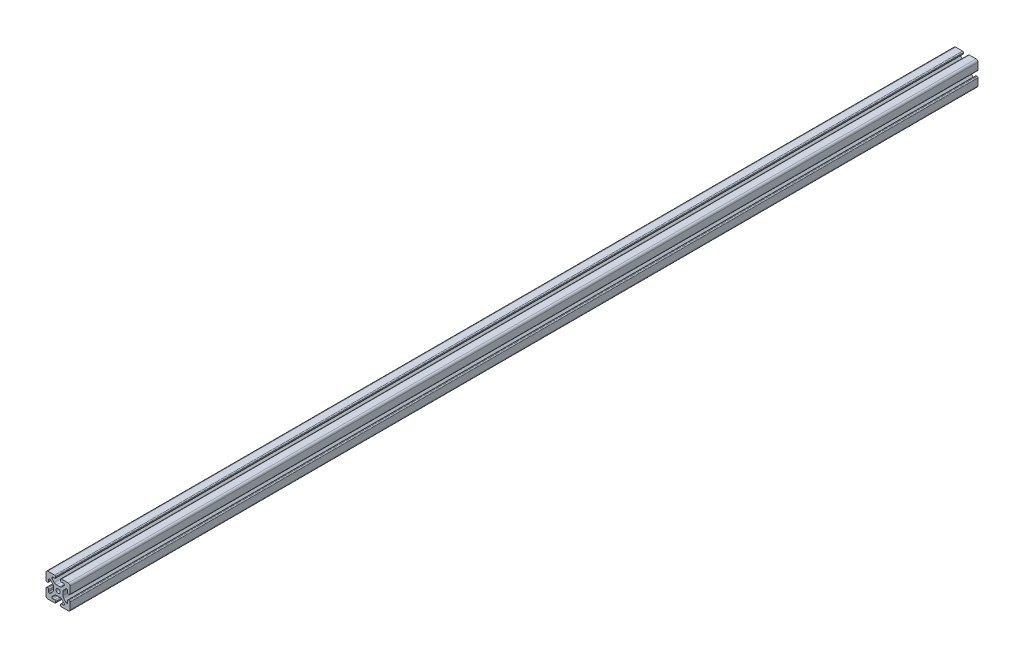
from build123d import *

# Parameters (mm, degrees)
SKETCH1_R      = 3.4
EXTRUDE1_DEPTH = 1500


with BuildPart() as part:
    # Sketch1 → Extrude1 (new body)
    with BuildSketch(Plane.XY):
        with BuildLine():
            Line((-8.715, -15.524615034), (-5.63, -15.524615034))
            ThreePointArc((-5.63, -15.524615034), (-4.519842354, -15.984457388), (-4.06, -17.094615034))
            Line((-4.06, -17.094615034), (-4.06, -18.43))
            ThreePointArc((-4.06, -18.43), (-4.519842354, -19.540157646), (-5.63, -20))
            Line((-5.63, -20), (-16.674615034, -20))
            ThreePointArc((-16.674615034, -20), (-18.951578385, -19.194274381), (-20, -17.018368134))
            Line((-20, -17.018368134), (-20, -5.757918808))
            ThreePointArc((-20, -5.757918808), (-19.564709668, -4.603883664), (-18.43, -4.120449326))
            Line((-18.43, -4.120449326), (-17.25, -4.120449326))
            ThreePointArc((-17.25, -4.120449326), (-16.115287682, -4.60388249), (-15.67999625, -5.757919334))
            Line((-15.67999625, -5.757919334), (-15.67999625, -8.715399492))
            ThreePointArc((-15.67999625, -8.715399492), (-15.220153896, -9.825557139), (-14.10999625, -10.285399492))
            Line((-14.10999625, -10.285399492), (-13.816898819, -10.285399492))
            ThreePointArc((-13.816898819, -10.285399492), (-13.526061711, -10.227547119), (-13.279501941, -10.062800646))
            Line((-13.279501941, -10.062800646), (-9.076242789, -5.859541495))
            ThreePointArc((-9.076242789, -5.859541495), (-8.046572221, -4.318530588), (-7.685, -2.500784284))
            Line((-7.685, -2.500784284), (-7.685, 2.500784284))
            ThreePointArc((-7.685, 2.500784284), (-8.046572221, 4.318530588), (-9.076242789, 5.859541495))
            Line((-9.076242789, 5.859541495), (-13.040489136, 9.823787841))
            ThreePointArc((-13.040489136, 9.823787841), (-13.354224618, 10.012729352), (-13.71989919, 10.033001362))
            Line((-13.71989919, 10.033001362), (-14.05520779, 10.044710596))
            ThreePointArc((-14.05520779, 10.044710596), (-15.200613642, 9.605030484), (-15.68, 8.475666998))
            Line((-15.68, 8.475666998), (-15.68, 5.572979049))
            ThreePointArc((-15.68, 5.572979049), (-16.139842354, 4.462821403), (-17.25, 4.002979049))
            Line((-17.25, 4.002979049), (-18.43, 4.002979049))
            ThreePointArc((-18.43, 4.002979049), (-19.540157646, 4.462821403), (-20, 5.572979049))
            Line((-20, 5.572979049), (-20, 13.004526564))
            Line((-20, 13.004526564), (-20, 16.83))
            ThreePointArc((-20, 16.83), (-19.071528496, 19.071528496), (-16.83, 20))
            Line((-16.83, 20), (-5.63, 20))
            ThreePointArc((-5.63, 20), (-4.519842354, 19.540157646), (-4.06, 18.43))
            Line((-4.06, 18.43), (-4.06, 17.094615034))
            ThreePointArc((-4.06, 17.094615034), (-4.519842354, 15.984457388), (-5.63, 15.524615034))
            Line((-5.63, 15.524615034), (-8.715, 15.524615034))
            ThreePointArc((-8.715, 15.524615034), (-9.825157646, 15.06477268), (-10.285, 13.954615034))
            Line((-10.285, 13.954615034), (-10.285, 13.492503602))
            ThreePointArc((-10.285, 13.492503602), (-10.227148445, 13.201664194), (-10.062401154, 12.955102448))
            Line((-10.062401154, 12.955102448), (-6.217092793, 9.109794088))
            ThreePointArc((-6.217092793, 9.109794088), (-4.63891877, 8.055291919), (-2.777335583, 7.685))
            Line((-2.777335583, 7.685), (2.777335583, 7.685))
            ThreePointArc((2.777335583, 7.685), (4.63891877, 8.055291919), (6.217092793, 9.109794088))
            Line((6.217092793, 9.109794088), (10.062401154, 12.955102448))
            ThreePointArc((10.062401154, 12.955102448), (10.227148445, 13.201664194), (10.285, 13.492503602))
            Line((10.285, 13.492503602), (10.285, 13.954615034))
            ThreePointArc((10.285, 13.954615034), (9.825157646, 15.06477268), (8.715, 15.524615034))
            Line((8.715, 15.524615034), (5.63, 15.524615034))
            ThreePointArc((5.63, 15.524615034), (4.519842354, 15.984457388), (4.06, 17.094615034))
            Line((4.06, 17.094615034), (4.06, 18.43))
            ThreePointArc((4.06, 18.43), (4.519842354, 19.540157646), (5.63, 20))
            Line((5.63, 20), (12.979635074, 20))
            Line((12.979635074, 20), (16.83, 20))
            ThreePointArc((16.83, 20), (19.071528496, 19.071528496), (20, 16.83))
            Line((20, 16.83), (20, 13.001098436))
            Line((20, 13.001098436), (20, 5.63))
            ThreePointArc((20, 5.63), (19.540157461, 4.519842693), (18.43, 4.060000526))
            Line((18.43, 4.060000526), (17.24999625, 4.060000526))
            ThreePointArc((17.24999625, 4.060000526), (16.139838603, 4.519842879), (15.67999625, 5.630000526))
            Line((15.67999625, 5.630000526), (15.67999625, 8.715399492))
            ThreePointArc((15.67999625, 8.715399492), (15.220153896, 9.825557139), (14.10999625, 10.285399492))
            Line((14.10999625, 10.285399492), (13.816903094, 10.285399492))
            ThreePointArc((13.816903094, 10.285399492), (13.526063686, 10.227547937), (13.279501941, 10.062800646))
            Line((13.279501941, 10.062800646), (9.076242789, 5.859541495))
            ThreePointArc((9.076242789, 5.859541495), (8.046572221, 4.318530588), (7.685, 2.500784284))
            Line((7.685, 2.500784284), (7.685, -2.500784284))
            ThreePointArc((7.685, -2.500784284), (8.046572221, -4.318530588), (9.076242789, -5.859541495))
            Line((9.076242789, -5.859541495), (13.163657296, -9.946956002))
            ThreePointArc((13.163657296, -9.946956002), (13.35903797, -10.160433474), (13.6200547, -10.285399492))
            Line((13.6200547, -10.285399492), (14.10999625, -10.285399492))
            ThreePointArc((14.10999625, -10.285399492), (15.220153896, -9.825557139), (15.67999625, -8.715399492))
            Line((15.67999625, -8.715399492), (15.67999625, -5.630000526))
            ThreePointArc((15.67999625, -5.630000526), (16.139838603, -4.519842879), (17.24999625, -4.060000526))
            Line((17.24999625, -4.060000526), (18.43, -4.060000526))
            ThreePointArc((18.43, -4.060000526), (19.540157461, -4.519842693), (20, -5.63))
            Line((20, -5.63), (20, -16.83))
            ThreePointArc((20, -16.83), (19.071528496, -19.071528496), (16.83, -20))
            Line((16.83, -20), (13, -20))
            Line((13, -20), (5.63, -20))
            ThreePointArc((5.63, -20), (4.519842354, -19.540157646), (4.06, -18.43))
            Line((4.06, -18.43), (4.06, -17.094615034))
            ThreePointArc((4.06, -17.094615034), (4.519842354, -15.984457388), (5.63, -15.524615034))
            Line((5.63, -15.524615034), (8.715, -15.524615034))
            ThreePointArc((8.715, -15.524615034), (9.825157646, -15.06477268), (10.285, -13.954615034))
            Line((10.285, -13.954615034), (10.285, -13.492503602))
            ThreePointArc((10.285, -13.492503602), (10.227148445, -13.201664194), (10.062401154, -12.955102448))
            Line((10.062401154, -12.955102448), (6.217092793, -9.109794088))
            ThreePointArc((6.217092793, -9.109794088), (4.63891877, -8.055291919), (2.777335583, -7.685))
            Line((2.777335583, -7.685), (-2.777335583, -7.685))
            ThreePointArc((-2.777335583, -7.685), (-4.63891877, -8.055291919), (-6.217092793, -9.109794088))
            Line((-6.217092793, -9.109794088), (-10.062401154, -12.955102448))
            ThreePointArc((-10.062401154, -12.955102448), (-10.227148445, -13.201664194), (-10.285, -13.492503602))
            Line((-10.285, -13.492503602), (-10.285, -13.954615034))
            ThreePointArc((-10.285, -13.954615034), (-9.825157646, -15.06477268), (-8.715, -15.524615034))
        make_face()
        Circle(SKETCH1_R, mode=Mode.SUBTRACT)
    extrude(amount=-EXTRUDE1_DEPTH)


solid = part.part
